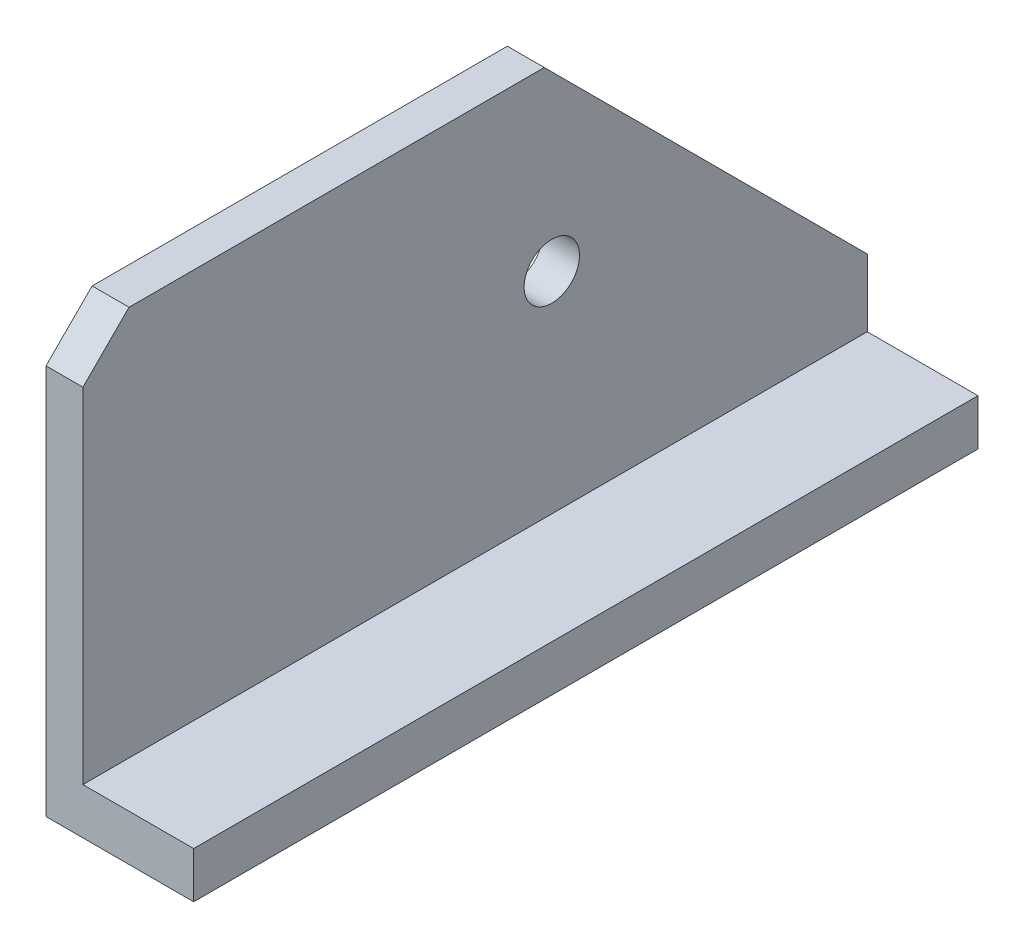
from build123d import *

# Parameters (mm, degrees)
EXTRUDE_1_DEPTH     = 85
SKETCH_2_R          = 3
CUT_EXTRUDE_1_DEPTH = 96.698955062
CHAMFER_1_SIZE      = 35
CHAMFER_2_SIZE      = 5


with BuildPart() as part:
    # Эскиз1 → Вытянуть1 (new body)
    with BuildSketch(Plane.XY):
        Polygon((0, 0), (12, 0), (12, -5), (-4, -5), (-4, 42.3), (0, 42.3), align=None)
    extrude(amount=EXTRUDE_1_DEPTH)

    # Эскиз2 → Вырез-Вытянуть1 (cut, through all)
    with BuildSketch(Plane(origin=(0, 0, 0), x_dir=(0, 0, -1), z_dir=(1, 0, 0))):
        with Locations((-34.186530765, 22.773427237)):
            Circle(SKETCH_2_R)
    extrude(amount=-CUT_EXTRUDE_1_DEPTH, mode=Mode.SUBTRACT)

    # Фаска1
    chamfer_1_edges = [part.edges().sort_by_distance(p)[0] for p in [
        (-2, 42.3, 0),
    ]]
    chamfer(chamfer_1_edges, length=CHAMFER_1_SIZE)

    # Фаска2
    chamfer_2_edges = [part.edges().sort_by_distance(p)[0] for p in [
        (-2, 42.3, 85),
    ]]
    chamfer(chamfer_2_edges, length=CHAMFER_2_SIZE)


solid = part.part
